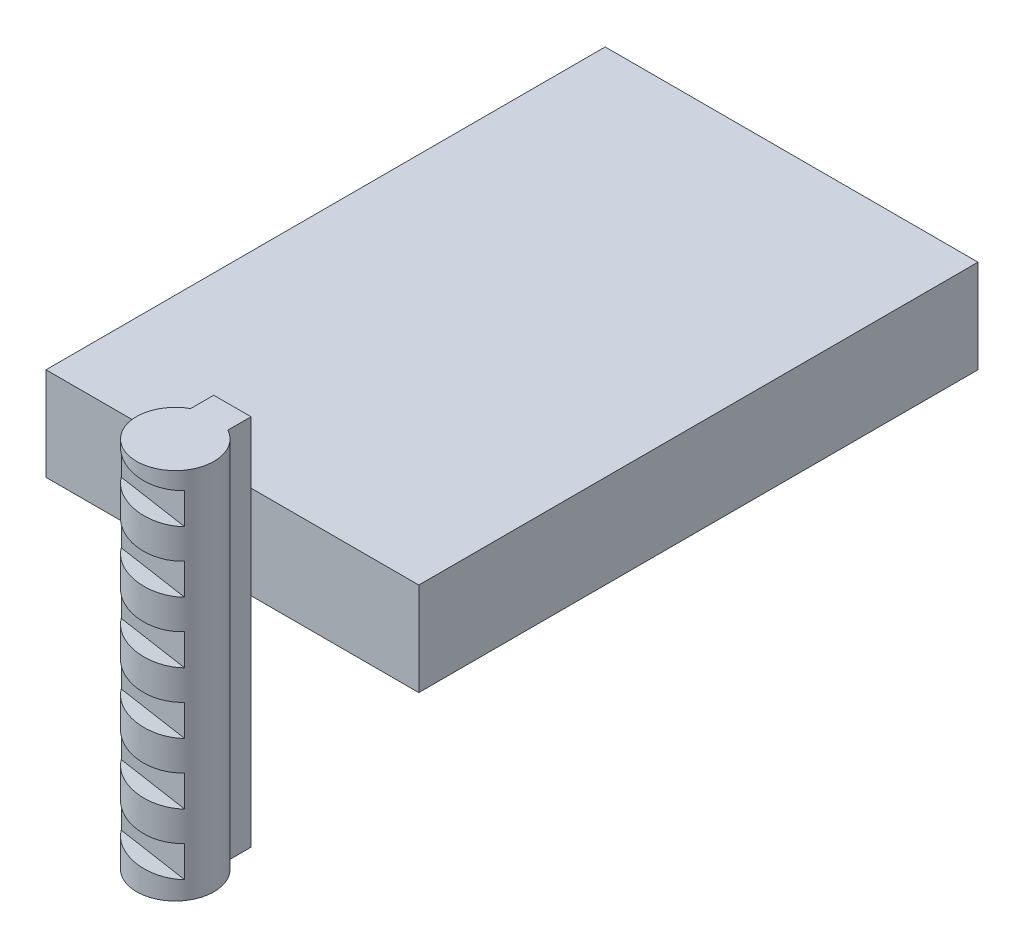
from build123d import *

# Parameters (mm, degrees)
BOSS_EXTRUDE1_DEPTH          = 25.4
SKETCH3_W                    = 25.4
SKETCH3_H                    = 6.35
BOSS_EXTRUDE3_DEPTH          = 38.1
CUT_EXTRUDE1_START           = 5.08
CUT_EXTRUDE1_DEPTH           = 3.556
CUT_EXTRUDE1_DRAFT           = 2
CUT_EXTRUDE1_PROFILE_2_DEPTH = 3.556
CUT_EXTRUDE1_PROFILE_2_DRAFT = 2
CUT_EXTRUDE1_PROFILE_3_DEPTH = 3.556
CUT_EXTRUDE1_PROFILE_3_DRAFT = 2
CUT_EXTRUDE1_PROFILE_4_DEPTH = 3.556
CUT_EXTRUDE1_PROFILE_4_DRAFT = 2
CUT_EXTRUDE1_PROFILE_5_DEPTH = 3.556
CUT_EXTRUDE1_PROFILE_5_DRAFT = 2
CUT_EXTRUDE1_PROFILE_6_DEPTH = 3.556
CUT_EXTRUDE1_PROFILE_6_DRAFT = 2


with BuildPart() as part:
    # Sketch1 → Boss-Extrude1 (new body)
    with BuildSketch(Plane(origin=(0, 0, 0), x_dir=(1, 0, 0), z_dir=(0, 1, 0))):
        with BuildLine():
            Line((-1.27, 3.89197217), (1.27, 3.89197217))
            Line((1.27, 3.89197217), (1.27, 2.315656298))
            ThreePointArc((1.27, 2.315656298), (0, -2.641053595), (-1.27, 2.315656298))
            Line((-1.27, 2.315656298), (-1.27, 3.89197217))
        make_face()
    extrude(amount=BOSS_EXTRUDE1_DEPTH)

    # Sketch3 → Boss-Extrude3 (add)
    with BuildSketch(Plane(origin=(0, 0, -3.89197217), x_dir=(-1, 0, 0), z_dir=(0, 0, -1))):
        with Locations((0, 18.011112495)):
            Rectangle(SKETCH3_W, SKETCH3_H)
    extrude(amount=BOSS_EXTRUDE3_DEPTH)


with BuildPart() as cut_extrude1_tool:
    # Sketch4 → Cut-Extrude1 (with draft: the straight prism first)
    with BuildSketch(Plane.XY.offset(CUT_EXTRUDE1_START)):
        Polygon((-3.113495219, 25.001271063), (-3.113495219, 23.121671063), (2.876409327, 22.06548928), (2.876409327, 23.94508928), align=None)
    extrude(amount=-CUT_EXTRUDE1_DEPTH)
    # Cut-Extrude1: the draft: its side faces are tilted about the plane it starts from
    cut_extrude1_sides = [cut_extrude1_tool.faces().sort_by_distance(p)[0] for p in [
        (-3.113495219, 24.061471063, 3.302),
        (-0.118542946, 22.593580171, 3.302),
        (2.876409327, 23.00528928, 3.302),
        (-0.118542946, 24.473180171, 3.302),
    ]]
    draft(cut_extrude1_sides, Plane.XY.offset(CUT_EXTRUDE1_START), CUT_EXTRUDE1_DRAFT)


with BuildPart() as part_1:
    add(part.part)

    # Cut-Extrude1: cut by cut_extrude1_tool
    add(cut_extrude1_tool.part, mode=Mode.SUBTRACT)


with BuildPart() as cut_extrude1_profile_2_tool:
    # Sketch4 → Cut-Extrude1 profile 2 (with draft: the straight prism first)
    with BuildSketch(Plane.XY.offset(CUT_EXTRUDE1_START)):
        Polygon((-3.113495219, 16.670071063), (-3.113495219, 14.790471063), (2.876409327, 13.73428928), (2.876409327, 15.61388928), align=None)
    extrude(amount=-CUT_EXTRUDE1_PROFILE_2_DEPTH)
    # Cut-Extrude1 profile 2: the draft: its side faces are tilted about the plane it starts from
    cut_extrude1_profile_2_sides = [cut_extrude1_profile_2_tool.faces().sort_by_distance(p)[0] for p in [
        (-3.113495219, 15.730271063, 3.302),
        (-0.118542946, 14.262380171, 3.302),
        (2.876409327, 14.67408928, 3.302),
        (-0.118542946, 16.141980171, 3.302),
    ]]
    draft(cut_extrude1_profile_2_sides, Plane.XY.offset(CUT_EXTRUDE1_START), CUT_EXTRUDE1_PROFILE_2_DRAFT)


with BuildPart() as part_2:
    add(part_1.part)

    # Cut-Extrude1 profile 2: cut by cut_extrude1_profile_2_tool
    add(cut_extrude1_profile_2_tool.part, mode=Mode.SUBTRACT)


with BuildPart() as cut_extrude1_profile_3_tool:
    # Sketch4 → Cut-Extrude1 profile 3 (with draft: the straight prism first)
    with BuildSketch(Plane.XY.offset(CUT_EXTRUDE1_START)):
        Polygon((-3.113495219, 20.835671063), (-3.113495219, 18.956071063), (2.876409327, 17.89988928), (2.876409327, 19.77948928), align=None)
    extrude(amount=-CUT_EXTRUDE1_PROFILE_3_DEPTH)
    # Cut-Extrude1 profile 3: the draft: its side faces are tilted about the plane it starts from
    cut_extrude1_profile_3_sides = [cut_extrude1_profile_3_tool.faces().sort_by_distance(p)[0] for p in [
        (-3.113495219, 19.895871063, 3.302),
        (-0.118542946, 18.427980171, 3.302),
        (2.876409327, 18.83968928, 3.302),
        (-0.118542946, 20.307580171, 3.302),
    ]]
    draft(cut_extrude1_profile_3_sides, Plane.XY.offset(CUT_EXTRUDE1_START), CUT_EXTRUDE1_PROFILE_3_DRAFT)


with BuildPart() as part_3:
    add(part_2.part)

    # Cut-Extrude1 profile 3: cut by cut_extrude1_profile_3_tool
    add(cut_extrude1_profile_3_tool.part, mode=Mode.SUBTRACT)


with BuildPart() as cut_extrude1_profile_4_tool:
    # Sketch4 → Cut-Extrude1 profile 4 (with draft: the straight prism first)
    with BuildSketch(Plane.XY.offset(CUT_EXTRUDE1_START)):
        Polygon((-3.113495219, 12.504471063), (-3.113495219, 10.624871063), (2.876409327, 9.56868928), (2.876409327, 11.44828928), align=None)
    extrude(amount=-CUT_EXTRUDE1_PROFILE_4_DEPTH)
    # Cut-Extrude1 profile 4: the draft: its side faces are tilted about the plane it starts from
    cut_extrude1_profile_4_sides = [cut_extrude1_profile_4_tool.faces().sort_by_distance(p)[0] for p in [
        (-3.113495219, 11.564671063, 3.302),
        (-0.118542946, 10.096780171, 3.302),
        (2.876409327, 10.50848928, 3.302),
        (-0.118542946, 11.976380171, 3.302),
    ]]
    draft(cut_extrude1_profile_4_sides, Plane.XY.offset(CUT_EXTRUDE1_START), CUT_EXTRUDE1_PROFILE_4_DRAFT)


with BuildPart() as part_4:
    add(part_3.part)

    # Cut-Extrude1 profile 4: cut by cut_extrude1_profile_4_tool
    add(cut_extrude1_profile_4_tool.part, mode=Mode.SUBTRACT)


with BuildPart() as cut_extrude1_profile_5_tool:
    # Sketch4 → Cut-Extrude1 profile 5 (with draft: the straight prism first)
    with BuildSketch(Plane.XY.offset(CUT_EXTRUDE1_START)):
        Polygon((-3.113495219, 8.338871063), (-3.113495219, 6.459271063), (2.876409327, 5.40308928), (2.876409327, 7.28268928), align=None)
    extrude(amount=-CUT_EXTRUDE1_PROFILE_5_DEPTH)
    # Cut-Extrude1 profile 5: the draft: its side faces are tilted about the plane it starts from
    cut_extrude1_profile_5_sides = [cut_extrude1_profile_5_tool.faces().sort_by_distance(p)[0] for p in [
        (-3.113495219, 7.399071063, 3.302),
        (-0.118542946, 5.931180171, 3.302),
        (2.876409327, 6.34288928, 3.302),
        (-0.118542946, 7.810780171, 3.302),
    ]]
    draft(cut_extrude1_profile_5_sides, Plane.XY.offset(CUT_EXTRUDE1_START), CUT_EXTRUDE1_PROFILE_5_DRAFT)


with BuildPart() as part_5:
    add(part_4.part)

    # Cut-Extrude1 profile 5: cut by cut_extrude1_profile_5_tool
    add(cut_extrude1_profile_5_tool.part, mode=Mode.SUBTRACT)


with BuildPart() as cut_extrude1_profile_6_tool:
    # Sketch4 → Cut-Extrude1 profile 6 (with draft: the straight prism first)
    with BuildSketch(Plane.XY.offset(CUT_EXTRUDE1_START)):
        Polygon((-3.113495219, 4.173271063), (-3.113495219, 2.293671063), (2.876409327, 1.23748928), (2.876409327, 3.11708928), align=None)
    extrude(amount=-CUT_EXTRUDE1_PROFILE_6_DEPTH)
    # Cut-Extrude1 profile 6: the draft: its side faces are tilted about the plane it starts from
    cut_extrude1_profile_6_sides = [cut_extrude1_profile_6_tool.faces().sort_by_distance(p)[0] for p in [
        (-3.113495219, 3.233471063, 3.302),
        (-0.118542946, 1.765580171, 3.302),
        (2.876409327, 2.17728928, 3.302),
        (-0.118542946, 3.645180171, 3.302),
    ]]
    draft(cut_extrude1_profile_6_sides, Plane.XY.offset(CUT_EXTRUDE1_START), CUT_EXTRUDE1_PROFILE_6_DRAFT)


with BuildPart() as part_6:
    add(part_5.part)

    # Cut-Extrude1 profile 6: cut by cut_extrude1_profile_6_tool
    add(cut_extrude1_profile_6_tool.part, mode=Mode.SUBTRACT)


solid = part_6.part
